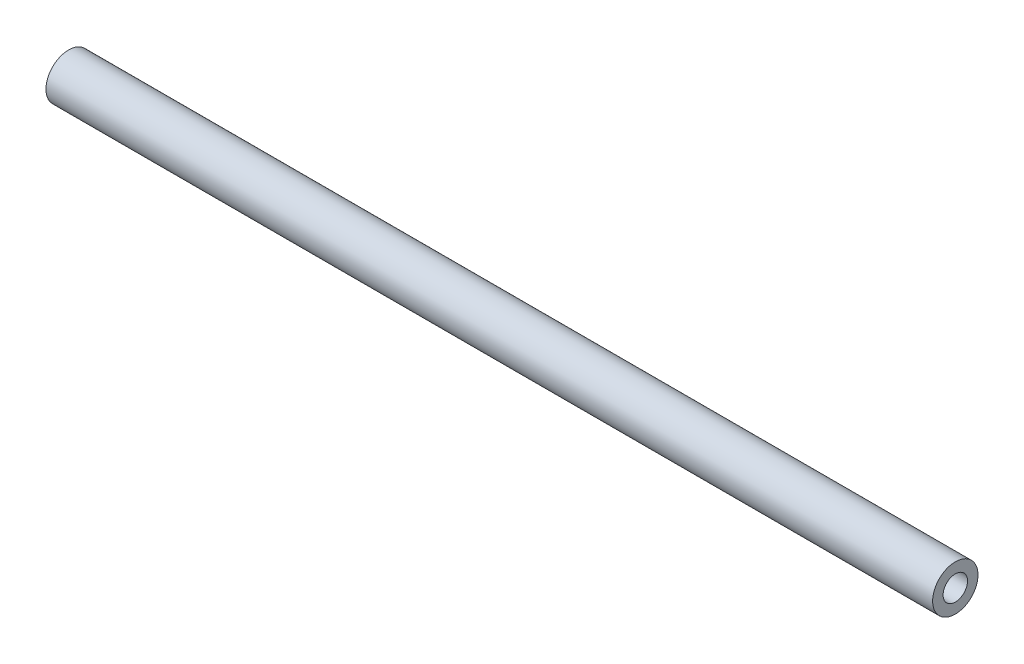
from build123d import *

# Parameters (mm, degrees)
SKETCH1_R           = 6.5
SKETCH1_R_2         = 3.5
BOSS_EXTRUDE1_DEPTH = 127


with BuildPart() as part:
    # Sketch1 → Boss-Extrude1 (new, symmetric)
    with BuildSketch(Plane(origin=(0, 0, 0), x_dir=(0, 0, -1), z_dir=(1, 0, 0))):
        Circle(SKETCH1_R)
        Circle(SKETCH1_R_2, mode=Mode.SUBTRACT)
    extrude(amount=BOSS_EXTRUDE1_DEPTH, both=True)


solid = part.part
